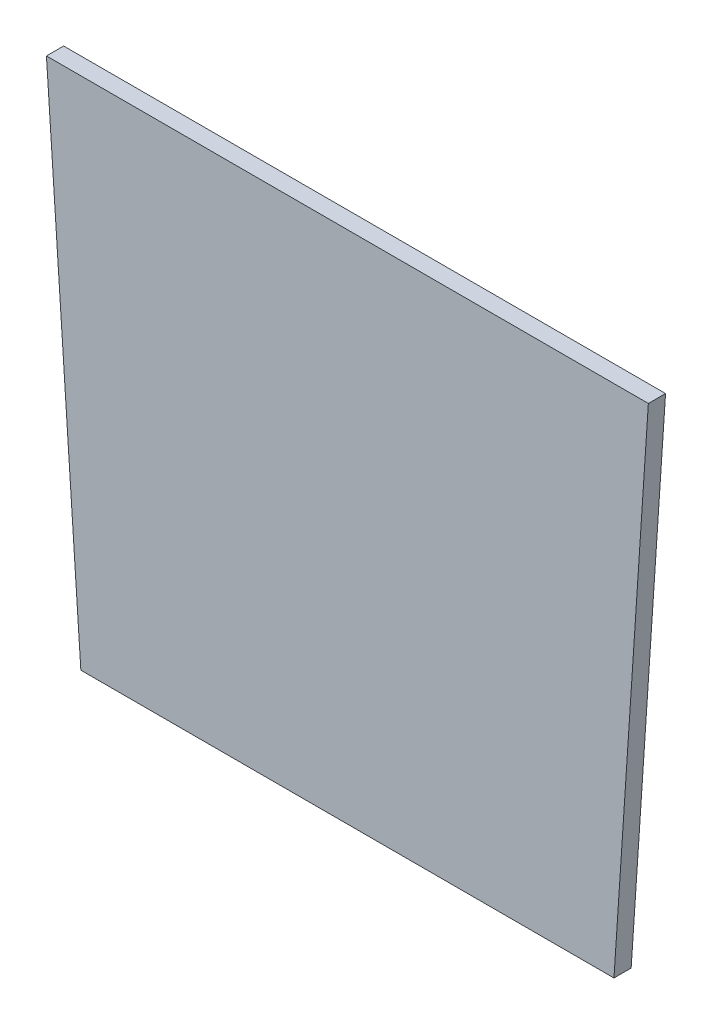
from build123d import *

# Parameters (mm, degrees)
DODANIE_WYCI_GNI_CIE1_DEPTH = 10


with BuildPart() as part:
    # Szkic1 → Dodanie-wyciągnięcie1 (new body)
    with BuildSketch(Plane.XY):
        Polygon((-175, 149.666295471), (175, 149.666295471), (155, -149.666295471), (-155, -149.666295471), align=None)
    extrude(amount=DODANIE_WYCI_GNI_CIE1_DEPTH)


solid = part.part
